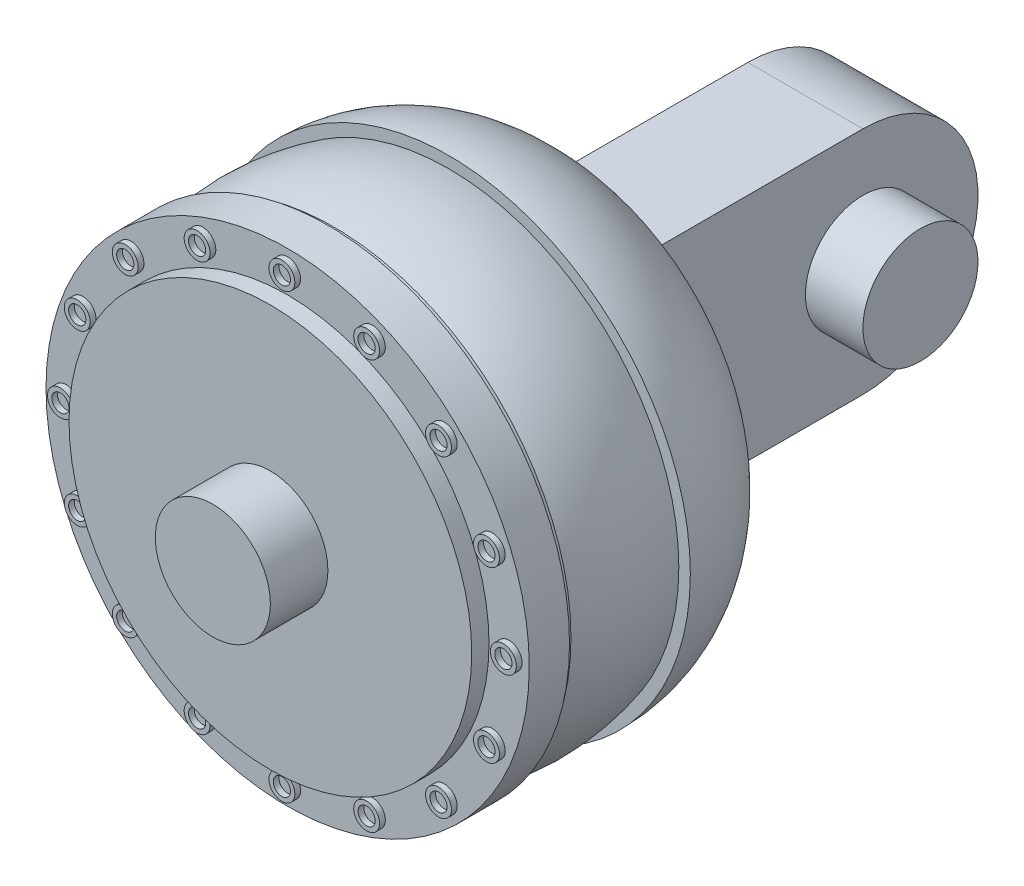
from build123d import *

# Parameters (mm, degrees)
SKETCH2_R            = 39.5
BOSS_EXTRUDE2_DEPTH  = 1
SKETCH6_R            = 41.25
BOSS_EXTRUDE3_DEPTH  = 1
SKETCH7_R            = 42
BOSS_EXTRUDE4_DEPTH  = 7
SKETCH8_R            = 35
BOSS_EXTRUDE5_DEPTH  = 3
BOSS_EXTRUDE6_DEPTH  = 1
CIRPATTERN1_COUNT    = 16
SKETCH10_W           = 20
SKETCH10_H           = 40
BOSS_EXTRUDE7_DEPTH  = 42
SKETCH11_R           = 20
BOSS_EXTRUDE8_DEPTH  = 20
SKETCH12_R           = 10
BOSS_EXTRUDE10_DEPTH = 10
SKETCH13_R           = 10
BOSS_EXTRUDE11_DEPTH = 10
BOSS_EXTRUDE12_START = 10
SKETCH14_R           = 10
BOSS_EXTRUDE12_DEPTH = 10


with BuildPart() as part:
    # Sketch1 → Revolve1 (revolve)
    with BuildSketch(Plane(origin=(0, 0, 0), x_dir=(1, 0, 0), z_dir=(0, 1, 0))):
        with BuildLine():
            Line((0, 0), (0, -20))
            Line((0, -20), (-42, -20))
            ThreePointArc((-42, -20), (-39.360679775, -8.819660113), (-32, 0))
            Line((-32, 0), (0, 0))
        make_face()
    revolve(axis=Axis((0, 0, 0), (0, 0, 1)))

    # Sketch2 → Boss-Extrude2 (add)
    with BuildSketch(Plane.XY.offset(20)):
        Circle(SKETCH2_R)
    extrude(amount=BOSS_EXTRUDE2_DEPTH)

    # Sketch5 → Revolve2 (revolve)
    with BuildSketch(Plane(origin=(0, 0, 0), x_dir=(1, 0, 0), z_dir=(0, 1, 0))):
        with BuildLine():
            Line((0, -20), (-40, -20))
            ThreePointArc((-40, -20), (-41.376973739, -30), (-40, -40))
            Line((-40, -40), (0, -40))
            Line((0, -40), (0, -20))
        make_face()
    revolve(axis=Axis((0, 0, 20), (0, 0, 1)))

    # Sketch6 → Boss-Extrude3 (add)
    with BuildSketch(Plane.XY.offset(40)):
        Circle(SKETCH6_R)
    extrude(amount=BOSS_EXTRUDE3_DEPTH)

    # Sketch7 → Boss-Extrude4 (add)
    with BuildSketch(Plane.XY.offset(41)):
        Circle(SKETCH7_R)
    extrude(amount=BOSS_EXTRUDE4_DEPTH)

    # Sketch8 → Boss-Extrude5 (add)
    with BuildSketch(Plane.XY.offset(48)):
        Circle(SKETCH8_R)
    extrude(amount=BOSS_EXTRUDE5_DEPTH)

    # Sketch9 → Boss-Extrude6 (add)
    with BuildSketch(Plane.XY.offset(48)):
        with BuildLine():
            ThreePointArc((37, 0), (38.5, 1.5), (40, 0))
            Line((40, 0), (40.75, 0))
            ThreePointArc((40.75, 0), (38.5, 2.25), (36.25, 0))
            Line((36.25, 0), (37, 0))
        make_face()
        with BuildLine():
            Line((40.75, 0), (40, 0))
            ThreePointArc((40, 0), (38.5, -1.5), (37, 0))
            Line((37, 0), (36.25, 0))
            ThreePointArc((36.25, 0), (38.5, -2.25), (40.75, 0))
        make_face()
    boss_extrude6 = extrude(amount=BOSS_EXTRUDE6_DEPTH)

    # CirPattern1: Boss-Extrude6 ×16 about axis
    cirpattern1_axis = Axis((0, 0, 0), (0, 0, 1))
    for i in range(1, CIRPATTERN1_COUNT):
        add(boss_extrude6.rotate(cirpattern1_axis, i * 360 / CIRPATTERN1_COUNT))

    # Sketch10 → Boss-Extrude7 (add)
    with BuildSketch(Plane(origin=(0, 0, 0), x_dir=(-1, 0, 0), z_dir=(0, 0, -1))):
        Rectangle(SKETCH10_W, SKETCH10_H)
    extrude(amount=BOSS_EXTRUDE7_DEPTH)

    # Sketch11 → Boss-Extrude8 (add)
    with BuildSketch(Plane.ZY.offset(10)):
        with Locations((-42, 0)):
            Circle(SKETCH11_R)
    extrude(amount=-BOSS_EXTRUDE8_DEPTH)

    # Sketch12 → Boss-Extrude10 (add)
    with BuildSketch(Plane.ZY.offset(10)):
        with Locations(Location((-42, 0, 0), (0, 0, 90))):
            Circle(SKETCH12_R)
    extrude(amount=BOSS_EXTRUDE10_DEPTH)

    # Sketch13 → Boss-Extrude11 (add)
    with BuildSketch(Plane.XY.offset(51)):
        Circle(SKETCH13_R)
    extrude(amount=BOSS_EXTRUDE11_DEPTH)

    # Sketch14 → Boss-Extrude12 (add)
    with BuildSketch(Plane(origin=(10, 0, 0), x_dir=(0, 0, -1), z_dir=(1, 0, 0)).offset(BOSS_EXTRUDE12_START)):
        with Locations(Location((42, 0, 0), (0, 0, 90))):
            Circle(SKETCH14_R)
    extrude(amount=-BOSS_EXTRUDE12_DEPTH)


solid = part.part
